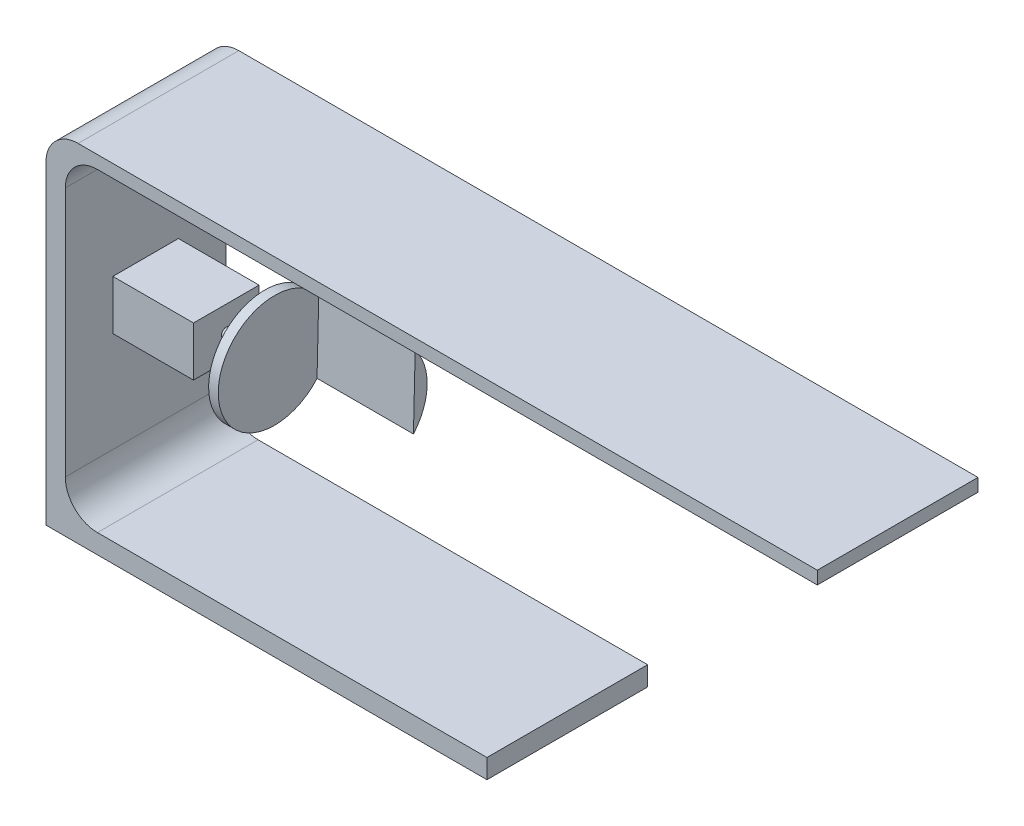
from build123d import *

# Parameters (mm, degrees)
BOSS_EXTRUDE1_DEPTH      = 25
BOSS_EXTRUDE1_DEPTH_BACK = 25
SKETCH2_W                = 20.4
SKETCH2_H                = 15.4
BOSS_EXTRUDE2_DEPTH      = 25.1
SKETCH3_R                = 1.5
BOSS_EXTRUDE3_DEPTH      = 12
SKETCH4_R                = 17.5
BOSS_EXTRUDE4_DEPTH      = 3
BOSS_EXTRUDE5_DEPTH      = 30


with BuildPart() as part:
    # Sketch1 → Boss-Extrude1 (new, two sides: drawn at the far end of the back side and taken through both)
    with BuildSketch(Plane.XY.offset(-BOSS_EXTRUDE1_DEPTH_BACK)):
        with BuildLine():
            Line((-102.79479724, 0), (102.79479724, 0))
            Line((102.79479724, 0), (102.79479724, -4))
            Line((102.79479724, -4), (-121.20520276, -4))
            ThreePointArc((-121.20520276, -4), (-128.276270572, -6.928932188), (-131.20520276, -14))
            Line((-131.20520276, -14), (-131.20520276, -91.867761665))
            ThreePointArc((-131.20520276, -91.867761665), (-128.276270572, -98.938829477), (-121.20520276, -101.867761665))
            Line((-121.20520276, -101.867761665), (0, -101.867761665))
            Line((0, -101.867761665), (0, -107.867761665))
            Line((0, -107.867761665), (-137.20520276, -107.867761665))
            Line((-137.20520276, -107.867761665), (-137.20520276, -10))
            ThreePointArc((-137.20520276, -10), (-134.276270572, -2.928932188), (-127.20520276, 0))
            Line((-127.20520276, 0), (-102.79479724, 0))
        make_face()
    extrude(amount=BOSS_EXTRUDE1_DEPTH + BOSS_EXTRUDE1_DEPTH_BACK)


with BuildPart() as body_2:
    # Sketch2 → Boss-Extrude2 (new body)
    with BuildSketch(Plane(origin=(-131.20520276, 0, 0), x_dir=(0, 0, -1), z_dir=(1, 0, 0))):
        with Locations((0, -52.933880832)):
            Rectangle(SKETCH2_W, SKETCH2_H)
    extrude(amount=BOSS_EXTRUDE2_DEPTH)


with BuildPart() as body_3:
    # Sketch3 → Boss-Extrude3 (new body)
    with BuildSketch(Plane(origin=(-106.10520276, 0, 0), x_dir=(0, 0, -1), z_dir=(1, 0, 0))):
        with Locations((0, -52.933880832)):
            Circle(SKETCH3_R)
    extrude(amount=BOSS_EXTRUDE3_DEPTH)

    # Sketch4 → Boss-Extrude4 (add)
    with BuildSketch(Plane(origin=(-94.10520276, 0, 0), x_dir=(0, 0, -1), z_dir=(1, 0, 0))):
        with Locations((0, -52.933880832)):
            Circle(SKETCH4_R)
    extrude(amount=BOSS_EXTRUDE4_DEPTH)

    # Sketch5 → Boss-Extrude5 (add)
    with BuildSketch(Plane(origin=(-91.10520276, 0, 0), x_dir=(0, 0, -1), z_dir=(1, 0, 0))):
        with BuildLine():
            Line((13.76915299, -42.132935229), (13.237108587, -64.380668865))
            ThreePointArc((13.237108587, -64.380668865), (17.494997973, -53.35226573), (13.76915299, -42.132935229))
        make_face()
    extrude(amount=BOSS_EXTRUDE5_DEPTH)


solid = Compound([part.part, body_2.part, body_3.part])
